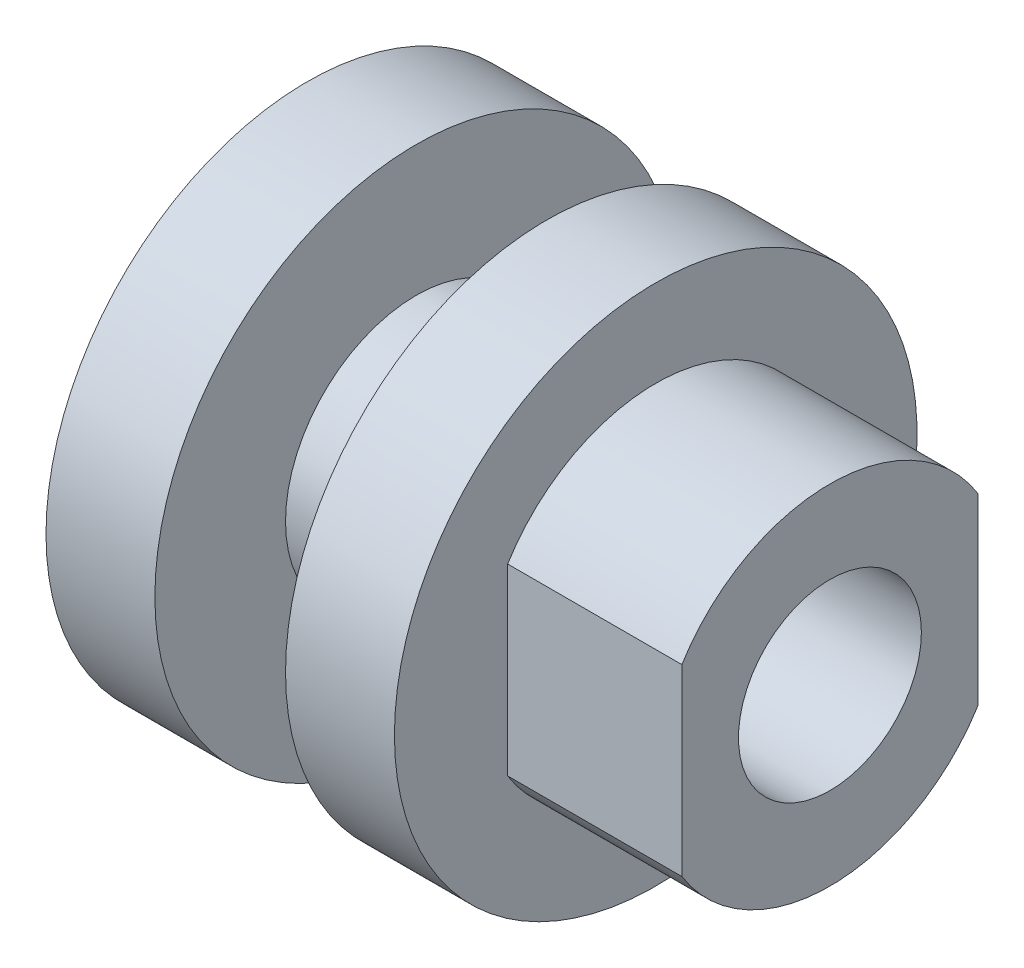
from build123d import *

# Parameters (mm, degrees)
HOLE_WIZARD_M5_1_D  = 4.2
SKETCH_6_W          = 0.6
SKETCH_6_H          = 4.214261502
CUT_EXTRUDE_1_DEPTH = 4


with BuildPart() as part:
    # 草图1 → 旋转1 (revolve)
    with BuildSketch(Plane(origin=(0, 0, 0), x_dir=(1, 0, 0), z_dir=(0, 1, 0)), mode=Mode.PRIVATE) as revolve_1_sk:
        Polygon((0, 0), (0, 6), (2.5, 6), (2.5, 3), (5.5, 3), (5.5, 6), (8, 6), (8, 4), (12, 4), (12, 0), align=None)
    revolve(revolve_1_sk.sketch.rotate(Axis((-1000, 0, 0), (1, 0, 0)), 180), axis=Axis((-1000, 0, 0), (1, 0, 0)))

    # M5 螺纹孔1 (through all)
    with Locations(Plane(origin=(12, 0, 0), x_dir=(0, 0, -1), z_dir=(1, 0, 0))):
        with Locations((0, 0)):
            Hole(HOLE_WIZARD_M5_1_D / 2)

    # 草图6 → 切除-拉伸1 (cut)
    with BuildSketch(Plane(origin=(12, 0, 0), x_dir=(0, 0, -1), z_dir=(1, 0, 0))):
        with Locations((-3.7, 0)):
            Rectangle(SKETCH_6_W, SKETCH_6_H)
        with Locations((3.7, 0)):
            Rectangle(SKETCH_6_W, SKETCH_6_H)
    extrude(amount=-CUT_EXTRUDE_1_DEPTH, mode=Mode.SUBTRACT)


solid = part.part
